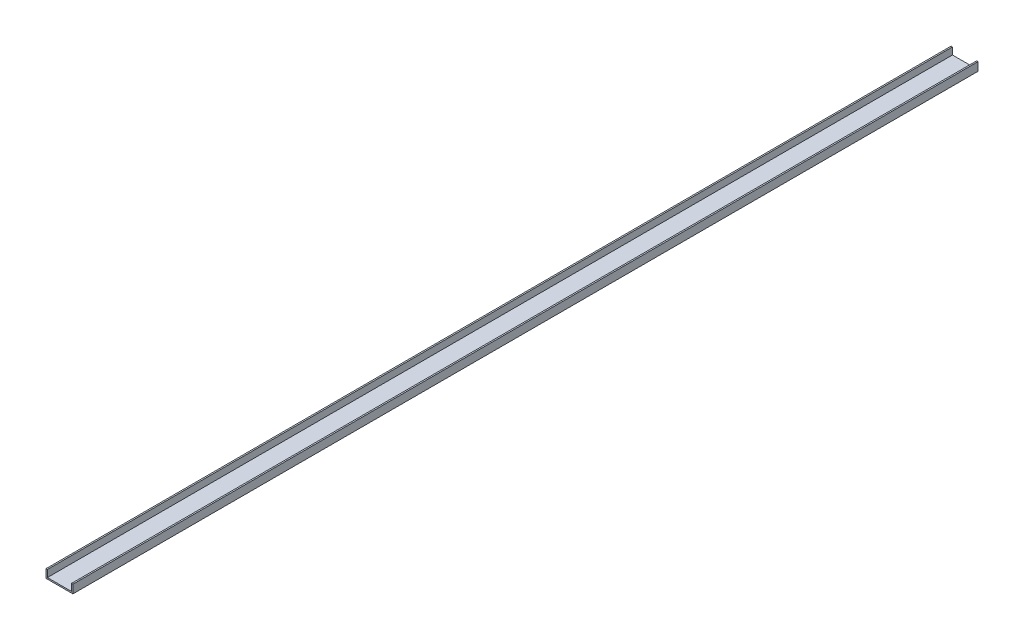
from build123d import *

# Parameters (mm, degrees)
BOSS_EXTRUDE1_DEPTH = 5124.45


with BuildPart() as part:
    # Sketch3 → Boss-Extrude1 (new body)
    with BuildSketch(Plane.XY):
        Polygon((-68.2625, 39.6875), (-68.2625, 0), (68.2625, 0), (68.2625, 39.6875), (76.2, 39.6875), (76.2, -7.9375), (-76.2, -7.9375), (-76.2, 39.6875), align=None)
    extrude(amount=BOSS_EXTRUDE1_DEPTH)


solid = part.part
